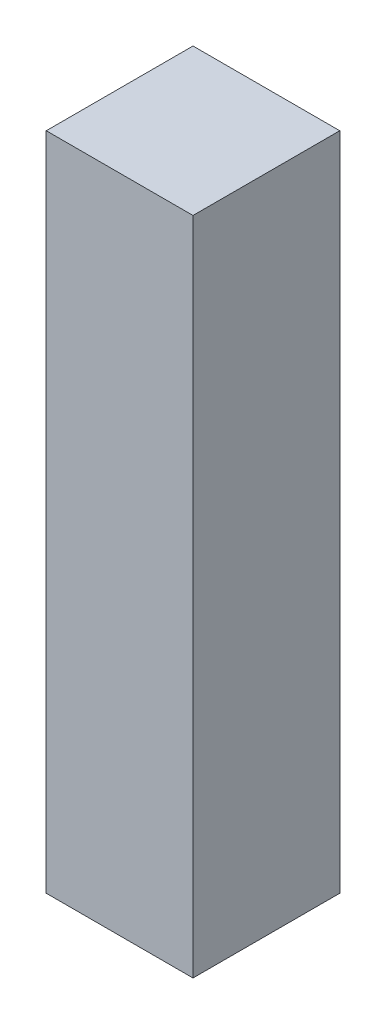
from build123d import *

# Parameters (mm, degrees)
SKETCH1_W           = 20
SKETCH1_H           = 20
BOSS_EXTRUDE1_DEPTH = 90


with BuildPart() as part:
    # Sketch1 → Boss-Extrude1 (new body)
    with BuildSketch(Plane(origin=(0, 0, 0), x_dir=(1, 0, 0), z_dir=(0, 1, 0))):
        Rectangle(SKETCH1_W, SKETCH1_H)
    extrude(amount=BOSS_EXTRUDE1_DEPTH)


solid = part.part
